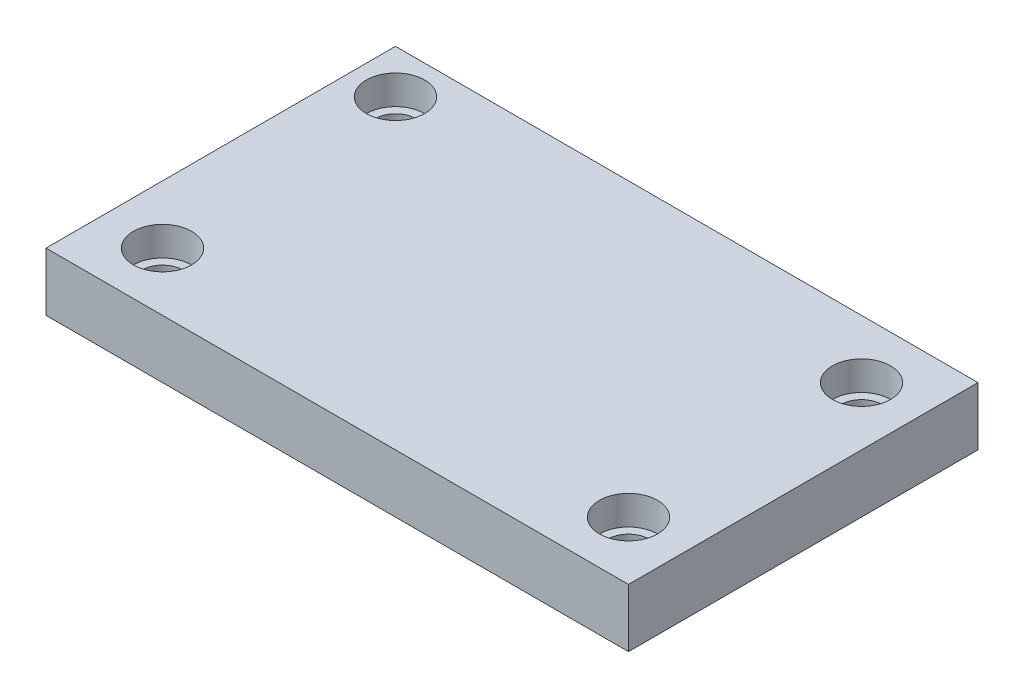
from build123d import *

# Parameters (mm, degrees)
SKETCH_1_W          = 20
SKETCH_1_H          = 12
SKETCH_1_R          = 0.7
EXTRUDE_1_DEPTH     = 2
CUT_EXTRUDE_START   = 2
SKETCH_1_3_R        = 1
CUT_EXTRUDE_1_DEPTH = 1


with BuildPart() as part:
    # 草图1 → 凸台-拉伸1 (new body)
    with BuildSketch(Plane(origin=(0, 0, 0), x_dir=(1, 0, 0), z_dir=(0, 1, 0))):
        with Locations((10, -6)):
            Rectangle(SKETCH_1_W, SKETCH_1_H)
        with Locations(Location((2, -10, 0), (0, 0, 270))):
            Circle(SKETCH_1_R, mode=Mode.SUBTRACT)
        with Locations(Location((1.5, -1.5, 0), (0, 0, 270))):
            Circle(SKETCH_1_R, mode=Mode.SUBTRACT)
        with Locations(Location((18, -2, 0), (0, 0, 270))):
            Circle(SKETCH_1_R, mode=Mode.SUBTRACT)
        with Locations(Location((18, -10, 0), (0, 0, 270))):
            Circle(SKETCH_1_R, mode=Mode.SUBTRACT)
    extrude(amount=EXTRUDE_1_DEPTH)

    # 草图1<3> → 切除-拉伸1 (cut)
    with BuildSketch(Plane(origin=(0, 0, 0), x_dir=(1, 0, 0), z_dir=(0, 1, 0)).offset(CUT_EXTRUDE_START)):
        with Locations(Location((2, -10, 0), (0, 0, 270))):
            Circle(SKETCH_1_3_R)
        with Locations(Location((1.5, -1.5, 0), (0, 0, 270))):
            Circle(SKETCH_1_3_R)
        with Locations(Location((18, -2, 0), (0, 0, 270))):
            Circle(SKETCH_1_3_R)
        with Locations(Location((18, -10, 0), (0, 0, 270))):
            Circle(SKETCH_1_3_R)
    extrude(amount=-CUT_EXTRUDE_1_DEPTH, mode=Mode.SUBTRACT)


solid = part.part
